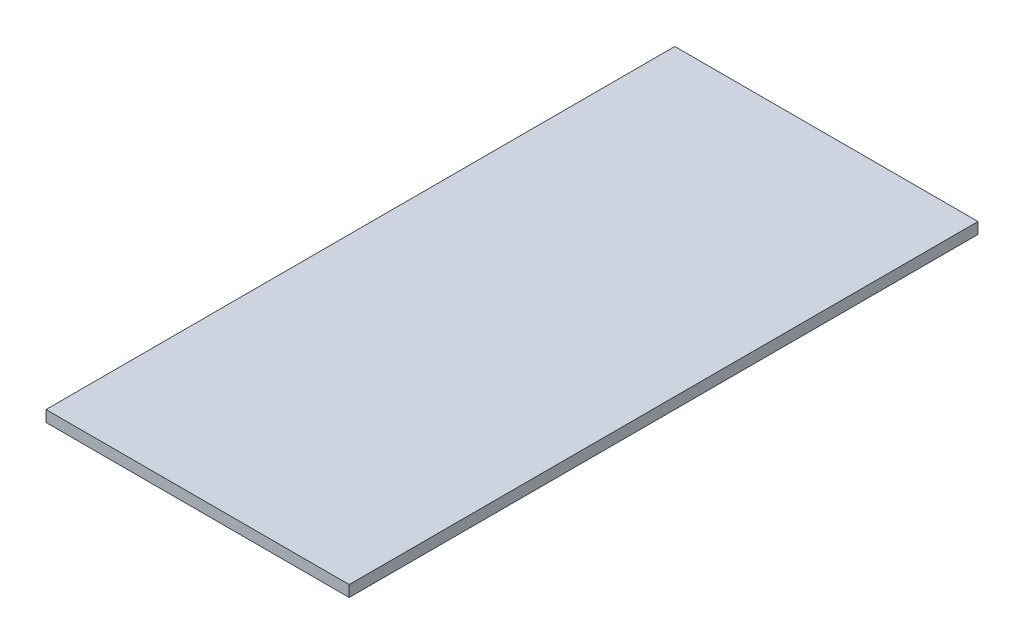
from build123d import *

# Parameters (mm, degrees)
SKETCH3_W           = 514.35
SKETCH3_H           = 1066.8
BOSS_EXTRUDE3_DEPTH = 19.05


with BuildPart() as part:
    # Sketch3 → Boss-Extrude3 (new body)
    with BuildSketch(Plane(origin=(0, 0, 0), x_dir=(1, 0, 0), z_dir=(0, 1, 0))):
        Rectangle(SKETCH3_W, SKETCH3_H)
    extrude(amount=BOSS_EXTRUDE3_DEPTH)


solid = part.part
